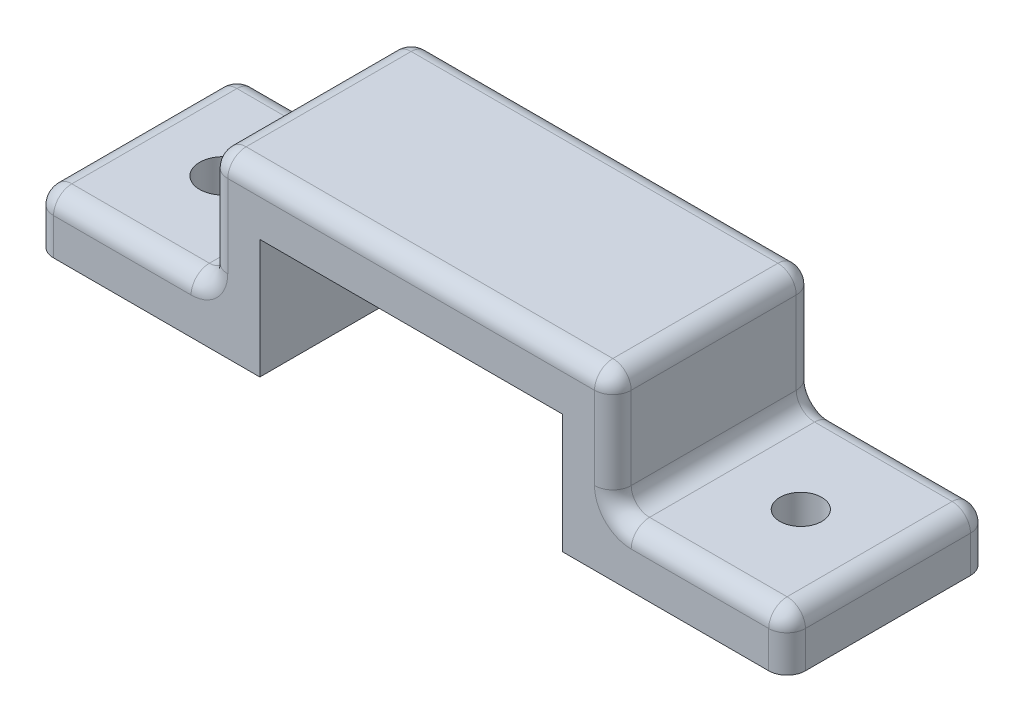
from build123d import *

# Parameters (mm, degrees)
SKETCH1_W           = 104.14
SKETCH1_H           = 27.94
SKETCH1_R           = 2.902024653
SKETCH1_R_2         = 3.261420209
BOSS_EXTRUDE1_DEPTH = 24.13
SKETCH2_W           = 41.91
SKETCH2_H           = 20.32
CUT_EXTRUDE1_DEPTH  = 16.51
SKETCH4_W           = 24.13
SKETCH4_H           = 27.94
CUT_EXTRUDE2_DEPTH  = 16.51
FILLET1_R           = 2.54


with BuildPart() as part:
    # Sketch1 → Boss-Extrude1 (new body)
    with BuildSketch(Plane(origin=(0, 0, 0), x_dir=(1, 0, 0), z_dir=(0, 1, 0))):
        Rectangle(SKETCH1_W, SKETCH1_H)
        with Locations(Location((40.005, 0, 0), (0, 0, 90))):
            Circle(SKETCH1_R, mode=Mode.SUBTRACT)
        with Locations(Location((-40.005, 0, 0), (0, 0, 90))):
            Circle(SKETCH1_R_2, mode=Mode.SUBTRACT)
    extrude(amount=BOSS_EXTRUDE1_DEPTH)

    # Sketch2 → Cut-Extrude1 (cut)
    with BuildSketch(Plane.XZ):
        with Locations((0, 3.81)):
            Rectangle(SKETCH2_W, SKETCH2_H)
    extrude(amount=-CUT_EXTRUDE1_DEPTH, mode=Mode.SUBTRACT)

    # Sketch4 → Cut-Extrude2 (cut)
    with BuildSketch(Plane(origin=(0, 24.13, 0), x_dir=(1, 0, 0), z_dir=(0, 1, 0))):
        with Locations((-40.005, 0)):
            Rectangle(SKETCH4_W, SKETCH4_H)
        with Locations((40.005, 0)):
            Rectangle(SKETCH4_W, SKETCH4_H)
    extrude(amount=-CUT_EXTRUDE2_DEPTH, mode=Mode.SUBTRACT)

    # Fillet1
    fillet1_edges = [part.edges().sort_by_distance(p)[0] for p in [
        (-20.955, 8.255, -6.35),
        (0, 16.51, -6.35),
        (20.955, 8.255, -6.35),
        (52.07, 3.81, 13.97),
        (0, 24.13, 13.97),
        (-52.07, 3.81, 13.97),
        (-52.07, 3.81, -13.97),
        (0, 24.13, -13.97),
        (52.07, 3.81, -13.97),
        (-52.07, 7.62, 0),
        (-40.005, 7.62, -13.97),
        (-27.94, 7.62, 0),
        (-27.94, 15.875, -13.97),
        (-40.005, 7.62, 13.97),
        (-27.94, 15.875, 13.97),
        (-27.94, 24.13, 0),
        (52.07, 7.62, 0),
        (40.005, 7.62, 13.97),
        (27.94, 7.62, 0),
        (27.94, 15.875, 13.97),
        (40.005, 7.62, -13.97),
        (27.94, 15.875, -13.97),
        (27.94, 24.13, 0),
    ]]
    fillet(fillet1_edges, radius=FILLET1_R)


solid = part.part
